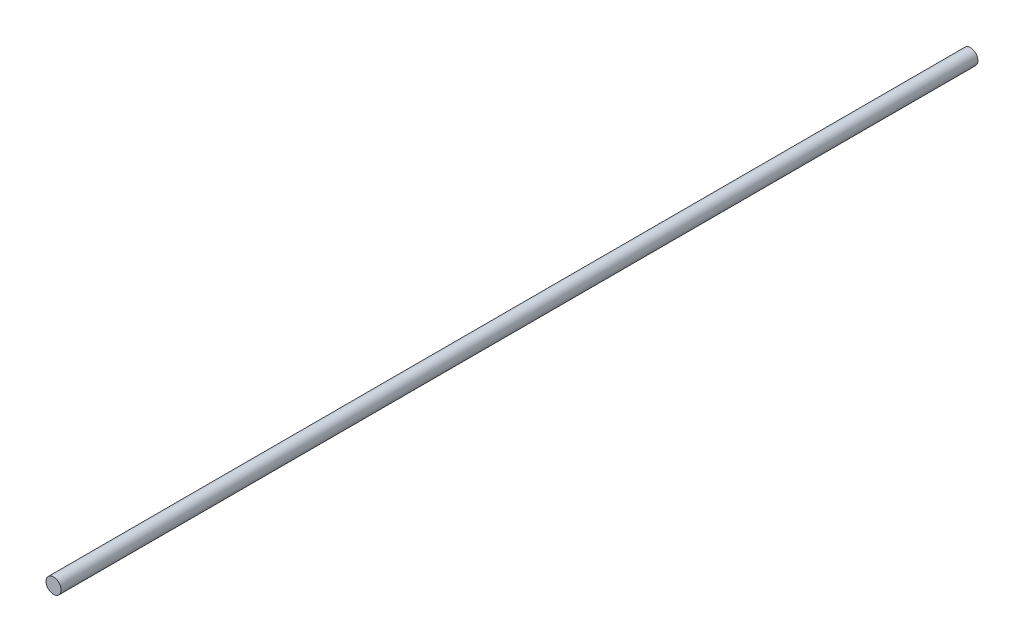
from build123d import *

# Parameters (mm, degrees)
SKETCH1_R           = 76.2
BOSS_EXTRUDE1_DEPTH = 9250.604541415


with BuildPart() as part:
    # Sketch1 → Boss-Extrude1 (new body)
    with BuildSketch(Plane.XY):
        with Locations(Location((0, 0, 0), (0, 0, 90))):
            Circle(SKETCH1_R)
    extrude(amount=BOSS_EXTRUDE1_DEPTH)


solid = part.part
